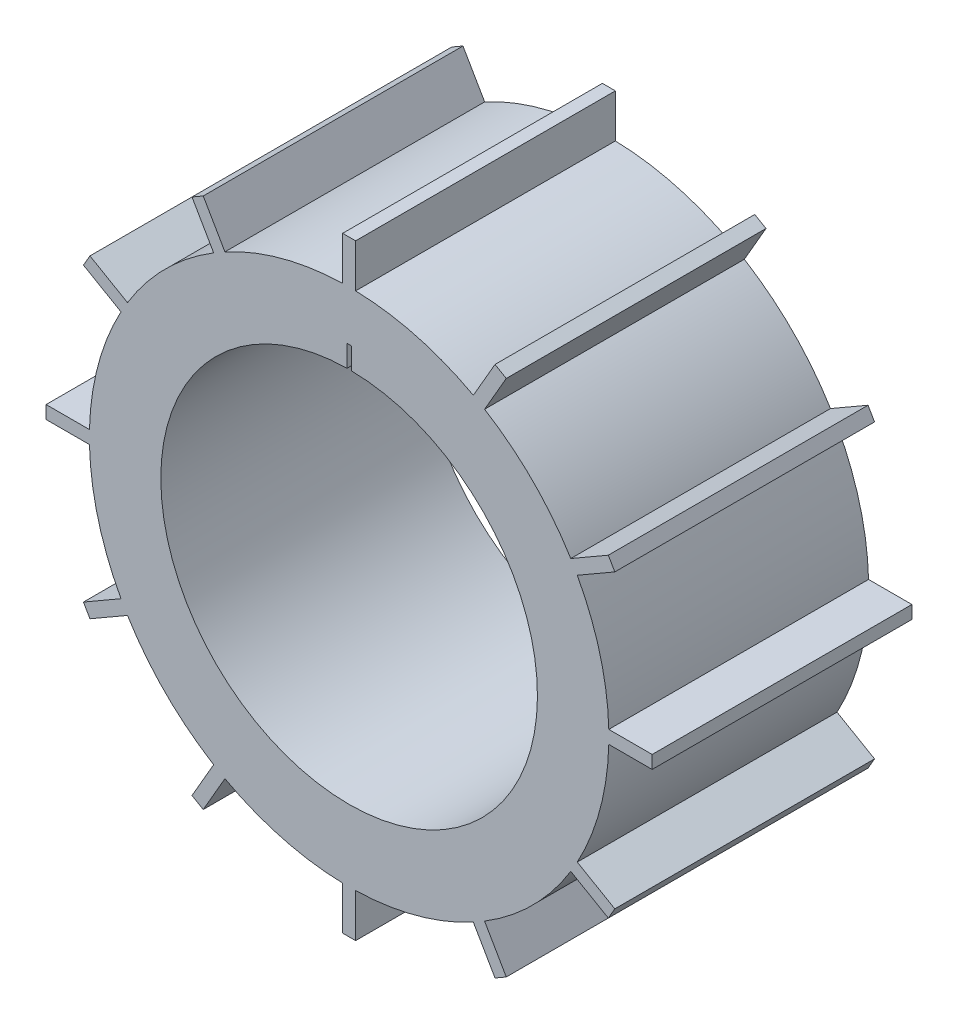
from build123d import *

# Parameters (mm, degrees)
SKETCH1_R           = 60
SKETCH1_R_2         = 43.5
EXTRUSION1_DEPTH    = 60
EXTRUSION3_START    = -60
EXTRUSION3_DEPTH    = 60
BOSS_EXTRUDE2_DEPTH = 60


with BuildPart() as part:
    # Sketch1 → Extrusion1 (new body)
    with BuildSketch(Plane.XY):
        Circle(SKETCH1_R)
        Circle(SKETCH1_R_2, mode=Mode.SUBTRACT)
    extrude(amount=EXTRUSION1_DEPTH)

    # Sketch3 → Extrusion3 (cut)
    with BuildSketch(Plane.XY.offset(60).offset(EXTRUSION3_START)):
        with BuildLine():
            Line((-0.5, 48.5), (-0.5, 43.497126342))
            ThreePointArc((-0.5, 43.497126342), (0, 43.5), (0.5, 43.497126342))
            Line((0.5, 43.497126342), (0.5, 48.5))
            Line((0.5, 48.5), (-0.5, 48.5))
        make_face()
    extrude(amount=EXTRUSION3_DEPTH, mode=Mode.SUBTRACT)

    # Sketch2 → Boss-Extrude2 (add, through all)
    with BuildSketch(Plane.XY.offset(60)):
        with BuildLine():
            Line((33.700961894, 61.371778265), (28.691585429, 52.695283713))
            ThreePointArc((28.691585429, 52.695283713), (30, 51.961524227), (31.28966164, 51.195283713))
            Line((31.28966164, 51.195283713), (36.299038106, 59.871778265))
            Line((36.299038106, 59.871778265), (33.700961894, 61.371778265))
        make_face()
        with BuildLine():
            Line((-1.5, 70), (-1.5, 59.981247069))
            ThreePointArc((-1.5, 59.981247069), (0, 60), (1.5, 59.981247069))
            Line((1.5, 59.981247069), (1.5, 70))
            Line((1.5, 70), (-1.5, 70))
        make_face()
        with BuildLine():
            Line((59.871778265, 36.299038106), (51.195283713, 31.28966164))
            ThreePointArc((51.195283713, 31.28966164), (51.961524227, 30), (52.695283713, 28.691585429))
            Line((52.695283713, 28.691585429), (61.371778265, 33.700961894))
            Line((61.371778265, 33.700961894), (59.871778265, 36.299038106))
        make_face()
        with BuildLine():
            Line((70, 1.5), (59.981247069, 1.5))
            ThreePointArc((59.981247069, 1.5), (60, 0), (59.981247069, -1.5))
            Line((59.981247069, -1.5), (70, -1.5))
            Line((70, -1.5), (70, 1.5))
        make_face()
        with BuildLine():
            Line((61.371778265, -33.700961894), (52.695283713, -28.691585429))
            ThreePointArc((52.695283713, -28.691585429), (51.961524227, -30), (51.195283713, -31.28966164))
            Line((51.195283713, -31.28966164), (59.871778265, -36.299038106))
            Line((59.871778265, -36.299038106), (61.371778265, -33.700961894))
        make_face()
        with BuildLine():
            Line((36.299038106, -59.871778265), (31.28966164, -51.195283713))
            ThreePointArc((31.28966164, -51.195283713), (30, -51.961524227), (28.691585429, -52.695283713))
            Line((28.691585429, -52.695283713), (33.700961894, -61.371778265))
            Line((33.700961894, -61.371778265), (36.299038106, -59.871778265))
        make_face()
        with BuildLine():
            Line((1.5, -70), (1.5, -59.981247069))
            ThreePointArc((1.5, -59.981247069), (0, -60), (-1.5, -59.981247069))
            Line((-1.5, -59.981247069), (-1.5, -70))
            Line((-1.5, -70), (1.5, -70))
        make_face()
        with BuildLine():
            Line((-33.700961894, -61.371778265), (-28.691585429, -52.695283713))
            ThreePointArc((-28.691585429, -52.695283713), (-30, -51.961524227), (-31.28966164, -51.195283713))
            Line((-31.28966164, -51.195283713), (-36.299038106, -59.871778265))
            Line((-36.299038106, -59.871778265), (-33.700961894, -61.371778265))
        make_face()
        with BuildLine():
            Line((-59.871778265, -36.299038106), (-51.195283713, -31.28966164))
            ThreePointArc((-51.195283713, -31.28966164), (-51.961524227, -30), (-52.695283713, -28.691585429))
            Line((-52.695283713, -28.691585429), (-61.371778265, -33.700961894))
            Line((-61.371778265, -33.700961894), (-59.871778265, -36.299038106))
        make_face()
        with BuildLine():
            Line((-70, -1.5), (-59.981247069, -1.5))
            ThreePointArc((-59.981247069, -1.5), (-60, 0), (-59.981247069, 1.5))
            Line((-59.981247069, 1.5), (-70, 1.5))
            Line((-70, 1.5), (-70, -1.5))
        make_face()
        with BuildLine():
            Line((-61.371778265, 33.700961894), (-52.695283713, 28.691585429))
            ThreePointArc((-52.695283713, 28.691585429), (-51.961524227, 30), (-51.195283713, 31.28966164))
            Line((-51.195283713, 31.28966164), (-59.871778265, 36.299038106))
            Line((-59.871778265, 36.299038106), (-61.371778265, 33.700961894))
        make_face()
        with BuildLine():
            Line((-36.299038106, 59.871778265), (-31.28966164, 51.195283713))
            ThreePointArc((-31.28966164, 51.195283713), (-30, 51.961524227), (-28.691585429, 52.695283713))
            Line((-28.691585429, 52.695283713), (-33.700961894, 61.371778265))
            Line((-33.700961894, 61.371778265), (-36.299038106, 59.871778265))
        make_face()
    extrude(amount=-BOSS_EXTRUDE2_DEPTH)


solid = part.part
